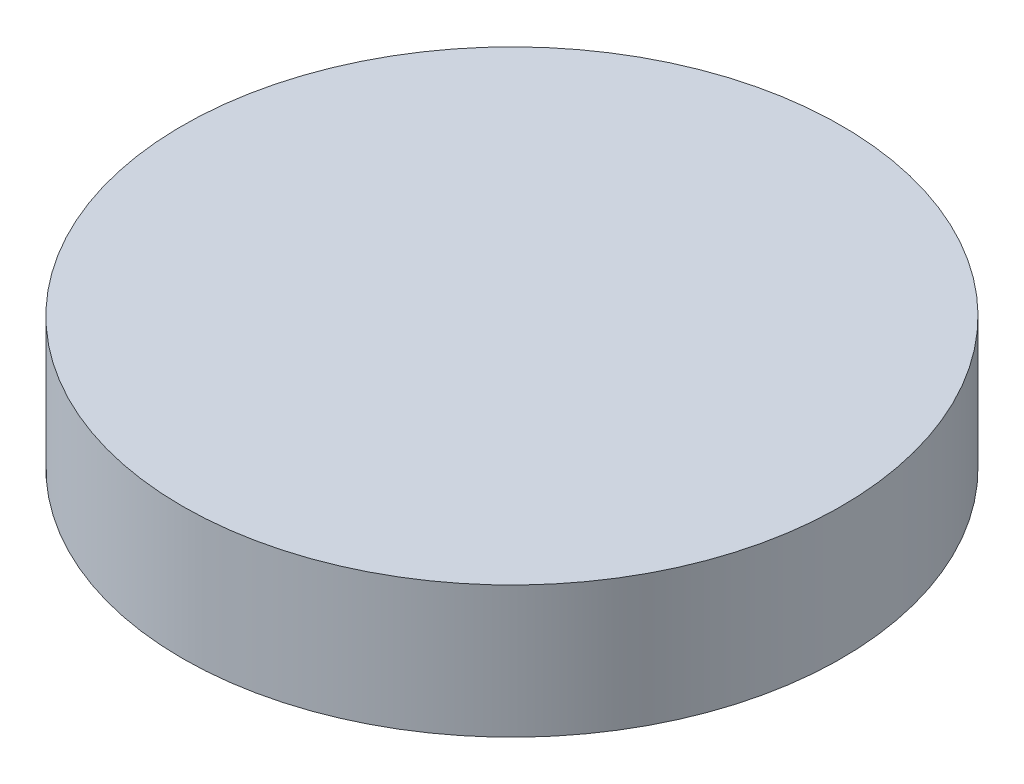
from build123d import *

# Parameters (mm, degrees)
KAPYAG_DOLUM_AGZI_D60_START = 260
SKETCH1_R                   = 30
KAPYAG_DOLUM_AGZI_D60_DEPTH = 12


with BuildPart() as part:
    # Sketch1 → KAPYAG_dolum_agzi_D60 (new body)
    with BuildSketch(Plane(origin=(0, 0, 0), x_dir=(1, 0, 0), z_dir=(0, 1, 0)).offset(KAPYAG_DOLUM_AGZI_D60_START)):
        with Locations(Location((0, 360, 0), (0, 0, 270))):
            Circle(SKETCH1_R)
    extrude(amount=KAPYAG_DOLUM_AGZI_D60_DEPTH)


solid = part.part
